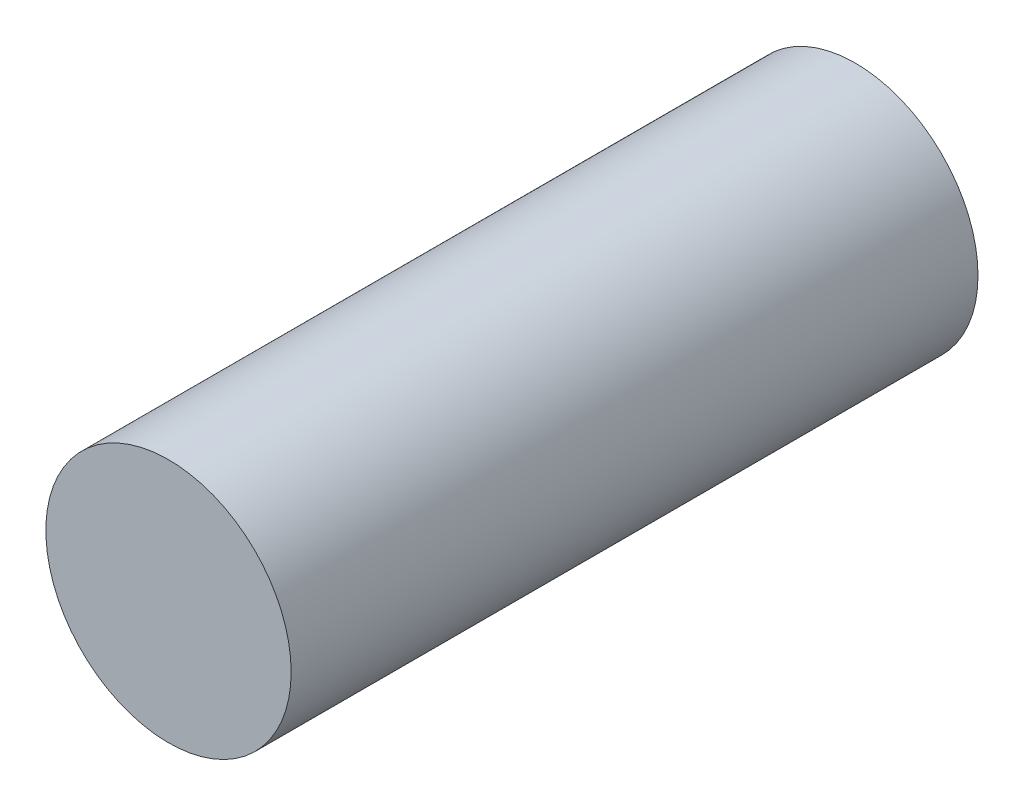
from build123d import *

# Parameters (mm, degrees)
SKETCH1_R           = 2.5
BOSS_EXTRUDE1_DEPTH = 14


with BuildPart() as part:
    # Sketch1 → Boss-Extrude1 (new body)
    with BuildSketch(Plane.XY):
        Circle(SKETCH1_R)
    extrude(amount=BOSS_EXTRUDE1_DEPTH)


solid = part.part
